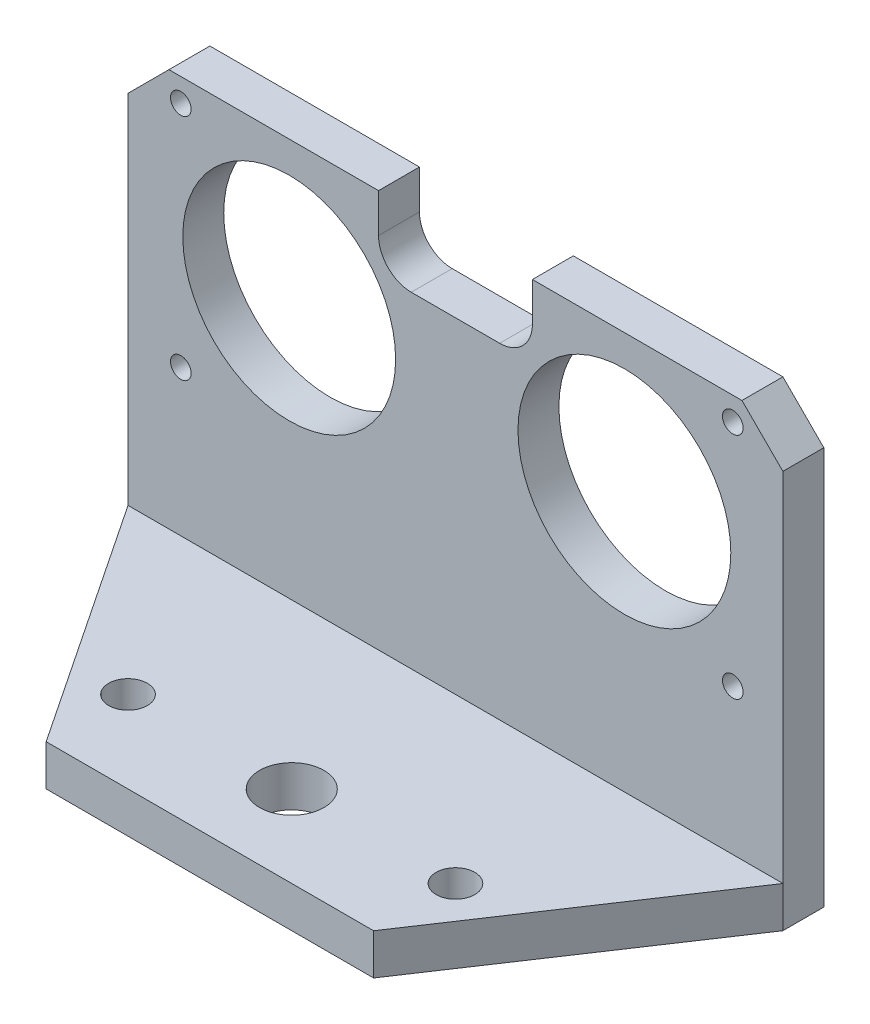
from build123d import *

# Parameters (mm, degrees)
SKETCH1_W             = 50.8
SKETCH1_H             = 34.036
BOSS_EXTRUDE1_DEPTH   = 1.5875
SKETCH2_W             = 50.8
SKETCH2_H             = 3.175
BOSS_EXTRUDE2_DEPTH   = 19.05
CHAMFER1_SIZE         = 12.7
F_3_0MM_DOWEL_HOLE1_D = 3
CHAMFER2_SIZE         = 3.175
CUT_EXTRUDE1_DEPTH    = 3.175
SKETCH7_R             = 8.255
CUT_EXTRUDE3_DEPTH    = 3.175
SKETCH8_R             = 8.255
CUT_EXTRUDE4_DEPTH    = 3.175
SKETCH9_R             = 0.8
CUT_EXTRUDE5_DEPTH    = 3.175
CUT_EXTRUDE6_DEPTH    = 3.175
SKETCH13_R            = 2.5
SKETCH13_R_2          = 1.5
CUT_EXTRUDE7_DEPTH    = 45.982971525


with BuildPart() as part:
    # Sketch1 → Boss-Extrude1 (new, symmetric)
    with BuildSketch(Plane.XY):
        Rectangle(SKETCH1_W, SKETCH1_H)
    extrude(amount=BOSS_EXTRUDE1_DEPTH, both=True)

    # Sketch2 → Boss-Extrude2 (add)
    with BuildSketch(Plane.XY.offset(1.5875)):
        with Locations((0, -15.4305)):
            Rectangle(SKETCH2_W, SKETCH2_H)
    extrude(amount=BOSS_EXTRUDE2_DEPTH)

    # Chamfer1
    chamfer1_edges = [part.edges().sort_by_distance(p)[0] for p in [
        (-25.4, -15.4305, 20.6375),
        (25.4, -15.4305, 20.6375),
    ]]
    chamfer(chamfer1_edges, length=CHAMFER1_SIZE)

    # Ø3.0mm Dowel Hole1 (through all)
    with Locations(Plane(origin=(0, -13.843, 0), x_dir=(1, 0, 0), z_dir=(0, 1, 0))):
        with Locations((-12.7, -14.2875), (12.7, -14.2875)):
            Hole(F_3_0MM_DOWEL_HOLE1_D / 2)

    # Chamfer2
    chamfer2_edges = [part.edges().sort_by_distance(p)[0] for p in [
        (25.4, 17.018, 0),
        (-25.4, 17.018, 0),
    ]]
    chamfer(chamfer2_edges, length=CHAMFER2_SIZE)

    # Sketch5 → Cut-Extrude1 (cut)
    with BuildSketch(Plane(origin=(0, 0, -1.5875), x_dir=(-1, 0, 0), z_dir=(0, 0, -1))):
        with BuildLine():
            Line((-5.969, 14.001104381), (-5.969, 17.018))
            Line((-5.969, 17.018), (5.969, 17.018))
            Line((5.969, 17.018), (5.969, 14.001104381))
            ThreePointArc((5.969, 14.001104381), (5.225051224, 12.205053157), (3.429, 11.461104381))
            Line((3.429, 11.461104381), (-3.429, 11.461104381))
            ThreePointArc((-3.429, 11.461104381), (-5.225051224, 12.205053157), (-5.969, 14.001104381))
        make_face()
    extrude(amount=-CUT_EXTRUDE1_DEPTH, mode=Mode.SUBTRACT)

    # Sketch7 → Cut-Extrude3 (cut)
    with BuildSketch(Plane(origin=(0, 0, -1.5875), x_dir=(-1, 0, 0), z_dir=(0, 0, -1))):
        with Locations((12.896, 6.34)):
            Circle(SKETCH7_R)
    extrude(amount=-CUT_EXTRUDE3_DEPTH, mode=Mode.SUBTRACT)

    # Sketch8 → Cut-Extrude4 (cut)
    with BuildSketch(Plane(origin=(0, 0, -1.5875), x_dir=(-1, 0, 0), z_dir=(0, 0, -1))):
        with Locations((-13.104, 6.34)):
            Circle(SKETCH8_R)
    extrude(amount=-CUT_EXTRUDE4_DEPTH, mode=Mode.SUBTRACT)

    # Sketch9 → Cut-Extrude5 (cut)
    with BuildSketch(Plane.XY.offset(1.5875)):
        with Locations((-21.306, 15.21)):
            Circle(SKETCH9_R)
        with Locations((21.514, 15.21)):
            Circle(SKETCH9_R)
        with Locations((21.514, -2.53)):
            Circle(SKETCH9_R)
        with Locations((-21.306, -2.53)):
            Circle(SKETCH9_R)
    extrude(amount=-CUT_EXTRUDE5_DEPTH, mode=Mode.SUBTRACT)

    # Sketch11 → Cut-Extrude6 (cut)
    with BuildSketch(Plane(origin=(0, -13.843, 0), x_dir=(1, 0, 0), z_dir=(0, 1, 0))):
        Polygon((-12.7, -20.6375), (-25.4, -1.5875), (-25.4, -7.9375), align=None)
        Polygon((25.4, -1.5875), (12.7, -20.6375), (25.4, -7.9375), align=None)
    extrude(amount=-CUT_EXTRUDE6_DEPTH, mode=Mode.SUBTRACT)

    # Sketch13 → Cut-Extrude7 (cut, through all)
    with BuildSketch(Plane(origin=(0, -13.843, 0), x_dir=(1, 0, 0), z_dir=(0, 1, 0))):
        with Locations(Location((0, -14.2875, 0), (0, 0, 270))):
            Circle(SKETCH13_R)
        with Locations(Location((-12.7, -14.2875, 0), (0, 0, 270))):
            Circle(SKETCH13_R_2)
        with Locations(Location((12.7, -14.2875, 0), (0, 0, 270))):
            Circle(SKETCH13_R_2)
    extrude(amount=-CUT_EXTRUDE7_DEPTH, mode=Mode.SUBTRACT)


solid = part.part
